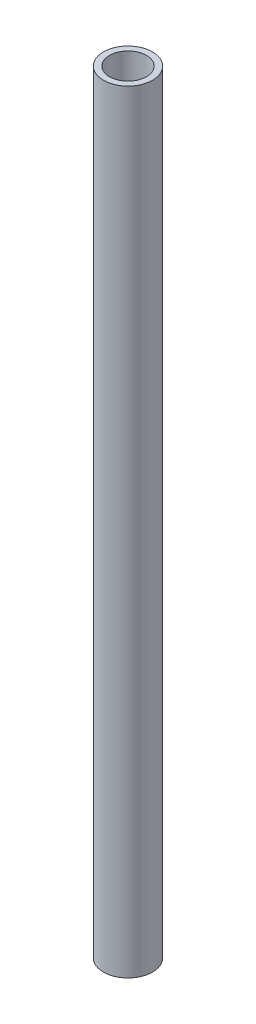
from build123d import *

# Parameters (mm, degrees)
SZKIC1_R                    = 16.85
SZKIC1_R_2                  = 12.7
DODANIE_WYCI_GNI_CIE1_DEPTH = 530


with BuildPart() as part:
    # Szkic1 → Dodanie-wyciągnięcie1 (new body)
    with BuildSketch(Plane(origin=(0, 0, 0), x_dir=(1, 0, 0), z_dir=(0, 1, 0))):
        with Locations(Location((0, 0, 0), (0, 0, 270))):
            Circle(SZKIC1_R)
        with Locations(Location((0, 0, 0), (0, 0, 270))):
            Circle(SZKIC1_R_2, mode=Mode.SUBTRACT)
    extrude(amount=DODANIE_WYCI_GNI_CIE1_DEPTH)


solid = part.part
